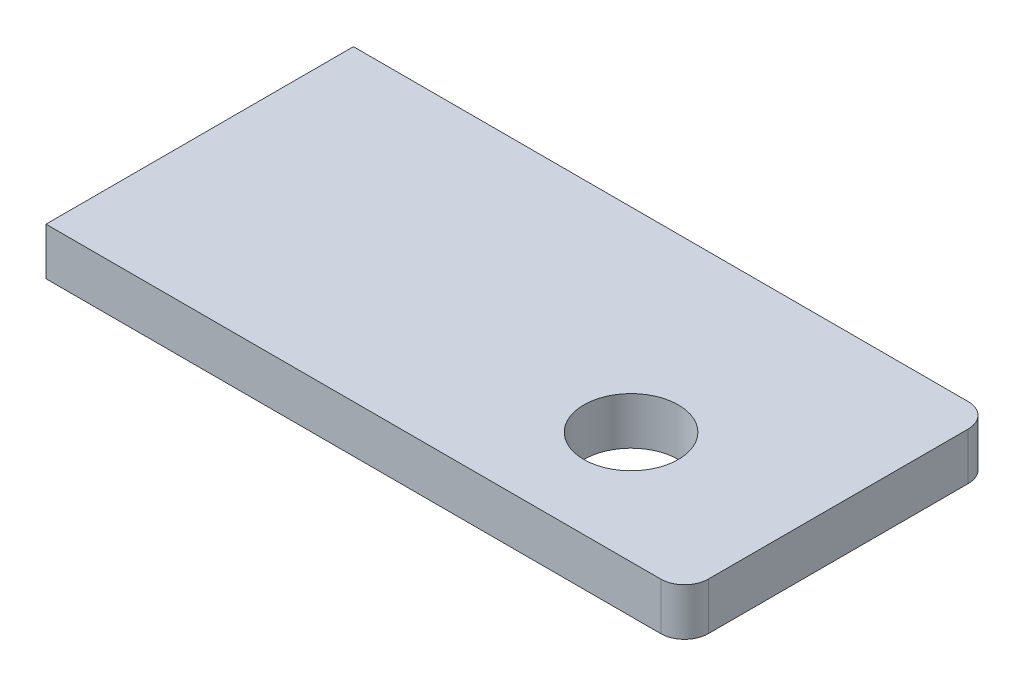
from build123d import *

# Parameters (mm, degrees)
SKETCH1_R           = 2
BOSS_EXTRUDE1_DEPTH = 2


with BuildPart() as part:
    # Sketch1 → Boss-Extrude1 (new body)
    with BuildSketch(Plane(origin=(0, 0, 0), x_dir=(1, 0, 0), z_dir=(0, 1, 0))):
        with BuildLine():
            Line((14.027461704, 3.38740458), (14.027461704, 10.632365856))
            ThreePointArc((14.027461704, 10.632365856), (13.733553665, 11.34192263), (13.023996891, 11.635830669))
            Line((13.023996891, 11.635830669), (-12.972538296, 11.635830669))
            Line((-12.972538296, 11.635830669), (-12.972538296, -1.364169331))
            Line((-12.972538296, -1.364169331), (13.023996891, -1.364169331))
            ThreePointArc((13.023996891, -1.364169331), (13.733553665, -1.070261292), (14.027461704, -0.360704518))
            Line((14.027461704, -0.360704518), (14.027461704, 3.38740458))
        make_face()
        with Locations(Location((7.015267176, 3.38740458, 0), (0, 0, 270))):
            Circle(SKETCH1_R, mode=Mode.SUBTRACT)
    extrude(amount=BOSS_EXTRUDE1_DEPTH)


solid = part.part
